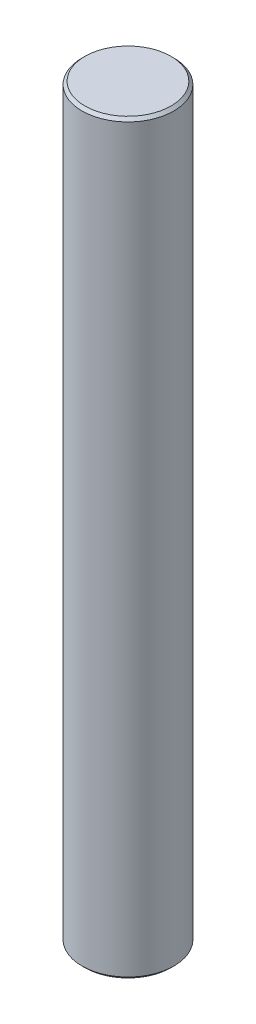
from build123d import *

# Parameters (mm, degrees)
SKETCH1_R           = 4
BOSS_EXTRUDE1_DEPTH = 65
CHAMFER1_SIZE       = 0.25


with BuildPart() as part:
    # Sketch1 → Boss-Extrude1 (new body)
    with BuildSketch(Plane(origin=(0, 0, 0), x_dir=(1, 0, 0), z_dir=(0, 1, 0))):
        with Locations(Location((0, 0, 0), (0, 0, 270))):
            Circle(SKETCH1_R)
    extrude(amount=BOSS_EXTRUDE1_DEPTH)

    # Chamfer1
    chamfer1_edges = [part.edges().sort_by_distance(p)[0] for p in [
        (0, 0, -4),
        (0, 65, -4),
    ]]
    chamfer(chamfer1_edges, length=CHAMFER1_SIZE)


solid = part.part
